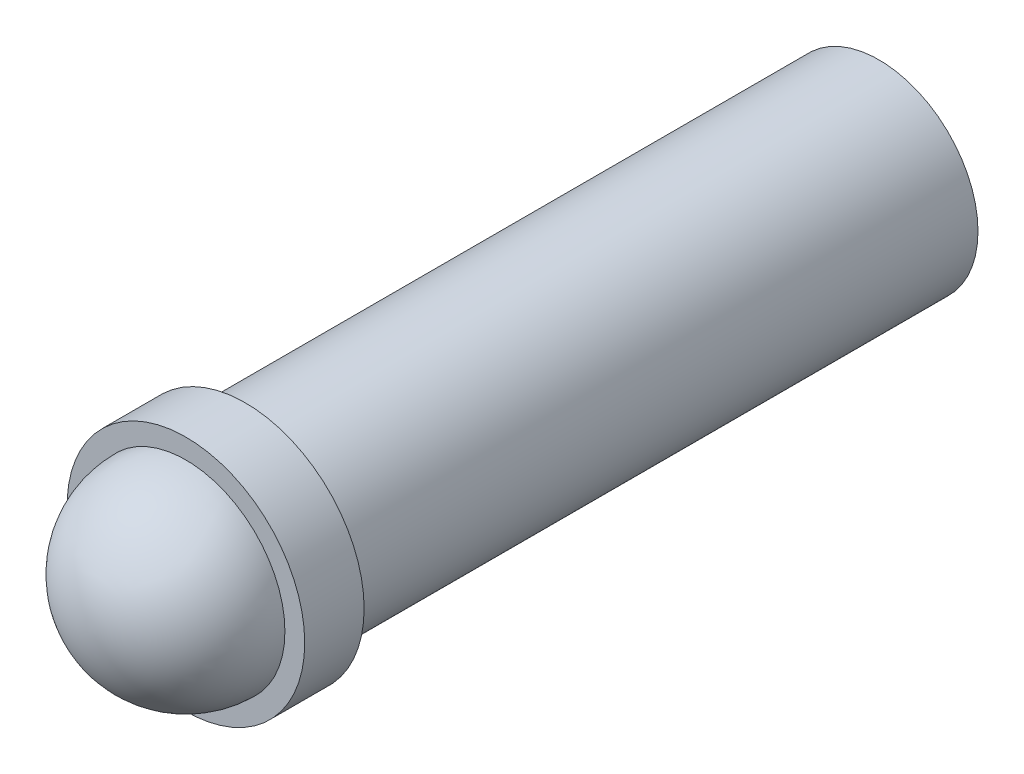
from build123d import *

# Parameters (mm, degrees)
SKETCH1_R           = 10
BOSS_EXTRUDE1_DEPTH = 80
FILLET1_R           = 10
BOSS_EXTRUDE2_START = 64
SKETCH2_R           = 12
SKETCH2_R_2         = 10
BOSS_EXTRUDE2_DEPTH = 6


with BuildPart() as part:
    # Sketch1 → Boss-Extrude1 (new body)
    with BuildSketch(Plane.XY):
        Circle(SKETCH1_R)
    extrude(amount=BOSS_EXTRUDE1_DEPTH)

    # Fillet1
    fillet1_edges = [part.edges().sort_by_distance(p)[0] for p in [
        (-10, 0, 80),
    ]]
    fillet(fillet1_edges, radius=FILLET1_R)

    # Sketch2 → Boss-Extrude2 (add)
    with BuildSketch(Plane.XY.offset(BOSS_EXTRUDE2_START)):
        Circle(SKETCH2_R)
        Circle(SKETCH2_R_2, mode=Mode.SUBTRACT)
    extrude(amount=BOSS_EXTRUDE2_DEPTH)


solid = part.part
